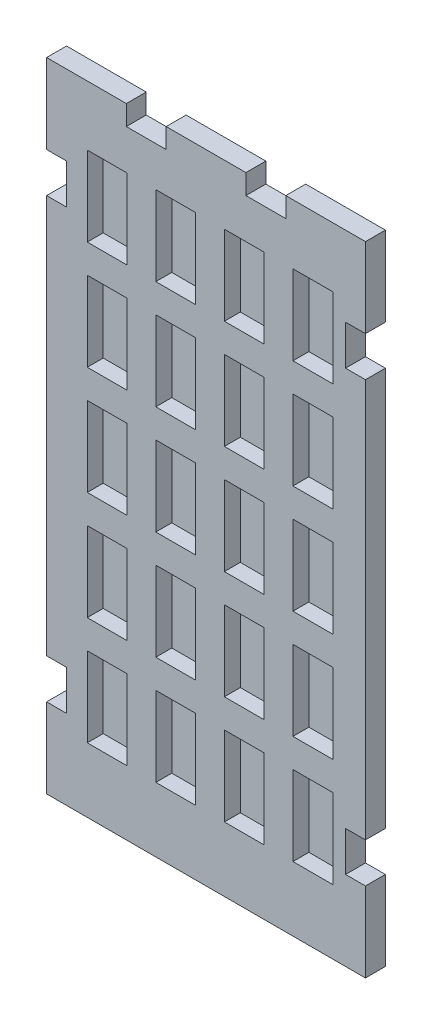
from build123d import *

# Parameters (mm, degrees)
BOSS_EXTRUDE1_DEPTH  = 3.175
SKETCH2_W            = 6.35
SKETCH2_H            = 12.7
CUT_EXTRUDE1_DEPTH   = 2.54
LPATTERN1_COUNT      = 4
LPATTERN1_PITCH      = 10.922
LPATTERN1_COUNT_DIR2 = 5
LPATTERN1_PITCH_DIR2 = 17.272


with BuildPart() as part:
    # Sketch1 → Boss-Extrude1 (new body)
    with BuildSketch(Plane.XY):
        Polygon((0, -101.6), (12.7, -101.6), (50.8, -101.6), (50.8, -88.9), (47.625, -88.9), (47.625, -82.55), (50.8, -82.55), (50.8, -19.05), (47.625, -19.05), (47.625, -12.7), (50.8, -12.7), (50.8, 0), (38.1, 0), (38.1, -3.175), (31.75, -3.175), (31.75, 0), (19.05, 0), (19.05, -3.175), (12.7, -3.175), (12.7, 0), (0, 0), (0, -12.7), (3.175, -12.7), (3.175, -19.05), (0, -19.05), (0, -82.55), (3.175, -82.55), (3.175, -88.9), (0, -88.9), align=None)
    extrude(amount=BOSS_EXTRUDE1_DEPTH)

    # Sketch2 → Cut-Extrude1 (cut)
    with BuildSketch(Plane.XY.offset(3.175)):
        with Locations((9.652, -15.875)):
            Rectangle(SKETCH2_W, SKETCH2_H)
    cut_extrude1 = extrude(amount=-CUT_EXTRUDE1_DEPTH, mode=Mode.SUBTRACT)

    # LPattern1: Cut-Extrude1 4 × 5
    with Locations(*[(i * LPATTERN1_PITCH, -j * LPATTERN1_PITCH_DIR2, 0) for i in range(LPATTERN1_COUNT) for j in range(LPATTERN1_COUNT_DIR2) if (i, j) != (0, 0)]):
        add(cut_extrude1, mode=Mode.SUBTRACT)


solid = part.part
